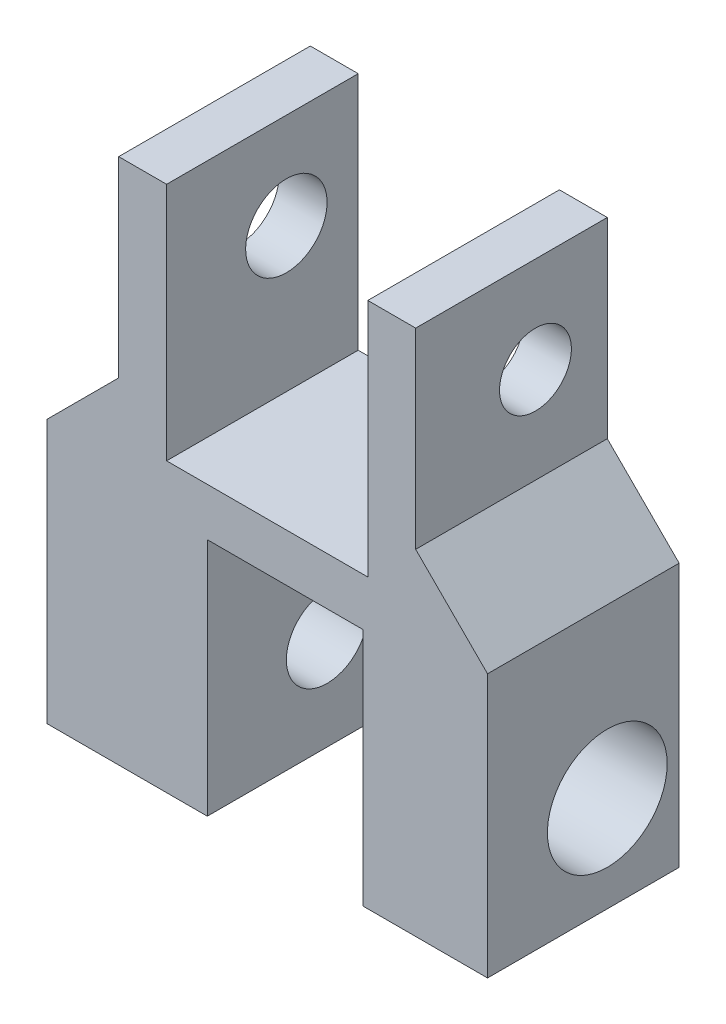
from build123d import *

# Parameters (mm, degrees)
AUFSATZ_LINEAR_AUSTRAGEN1_DEPTH = 8
SKIZZE3_R                       = 2.5
SCHNITT_LINEAR_AUSTRAGEN1_DEPTH = 10
SCHNITT_LINEAR_AUSTRAGEN2_REACH = 25.379
SKIZZE4_R                       = 1.7
SCHNITT_LINEAR_AUSTRAGEN3_REACH = 23.099
SKIZZE5_R                       = 1.7
SKIZZE6_R                       = 1.5
SCHNITT_LINEAR_AUSTRAGEN4_DEPTH = 5


with BuildPart() as part:
    # Skizze2 → Aufsatz-Linear austragen1 (new body)
    with BuildSketch(Plane.XY):
        Polygon((-4.2, 0), (4.2, 0), (4.2, 10), (6.2, 10), (6.2, 2), (9.2, -1), (9.2, -12), (4, -12), (4, -2), (0, -2), (-2.5, -2), (-2.5, -12), (-9.2, -12), (-9.2, -1), (-6.2, 2), (-6.2, 10), (-4.2, 10), align=None)
    extrude(amount=AUFSATZ_LINEAR_AUSTRAGEN1_DEPTH)

    # Skizze3 → Schnitt-Linear austragen1 (cut)
    with BuildSketch(Plane.ZY.offset(-9.2)):
        with Locations(Location((3, -8, 0), (0, 0, 180))):
            Circle(SKIZZE3_R)
    extrude(amount=SCHNITT_LINEAR_AUSTRAGEN1_DEPTH, mode=Mode.SUBTRACT)

    # Skizze4 → Schnitt-Linear austragen2 (cut, up to next)
    with BuildSketch(Plane.ZY.offset(9.2), mode=Mode.PRIVATE) as schnitt_linear_austragen2_sk1:
        with Locations((3, -8)):
            Circle(SKIZZE4_R)
    schnitt_linear_austragen2_tool1 = extrude(schnitt_linear_austragen2_sk1.sketch, amount=-SCHNITT_LINEAR_AUSTRAGEN2_REACH, mode=Mode.PRIVATE) & part.part
    add(schnitt_linear_austragen2_tool1.solids().sort_by_distance((-9.2, -8, 3))[0], mode=Mode.SUBTRACT)

    # Skizze5 → Schnitt-Linear austragen3 (cut, up to next)
    with BuildSketch(Plane.ZY.offset(6.2), mode=Mode.PRIVATE) as schnitt_linear_austragen3_sk1:
        with Locations(Location((3, 6, 0), (0, 0, 270))):
            Circle(SKIZZE5_R)
    schnitt_linear_austragen3_tool1 = extrude(schnitt_linear_austragen3_sk1.sketch, amount=-SCHNITT_LINEAR_AUSTRAGEN3_REACH, mode=Mode.PRIVATE) & part.part
    add(schnitt_linear_austragen3_tool1.solids().sort_by_distance((-6.2, 6, 3))[0], mode=Mode.SUBTRACT)

    # Skizze6 → Schnitt-Linear austragen4 (cut)
    with BuildSketch(Plane.ZY.offset(-4.2)):
        with Locations(Location((3, 6, 0), (0, 0, 270))):
            Circle(SKIZZE6_R)
    extrude(amount=-SCHNITT_LINEAR_AUSTRAGEN4_DEPTH, mode=Mode.SUBTRACT)


solid = part.part
